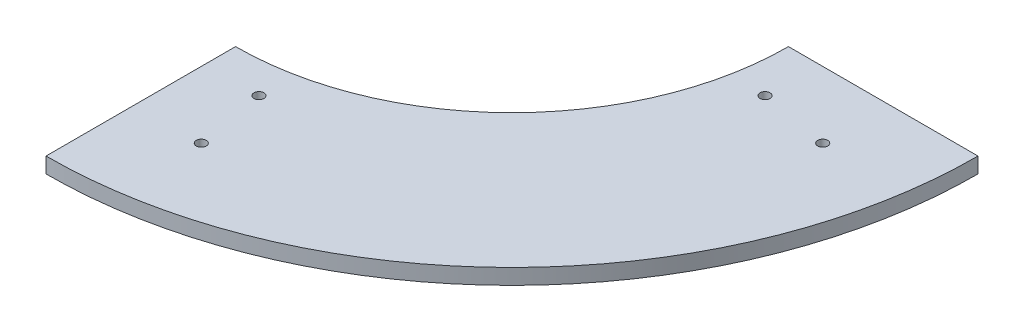
from build123d import *

# Parameters (mm, degrees)
BOSS_EXTRUDE1_DEPTH = 6.25
SKETCH2_R           = 2
CUT_EXTRUDE1_DEPTH  = 6.35


with BuildPart() as part:
    # Sketch1 → Boss-Extrude1 (new body)
    with BuildSketch(Plane(origin=(0, 0, 0), x_dir=(1, 0, 0), z_dir=(0, 1, 0))):
        with BuildLine():
            Line((111.125, 0), (187.325, 0))
            ThreePointArc((187.325, 0), (132.458777786, -132.458777786), (0, -187.325))
            Line((0, -187.325), (0, -111.125))
            ThreePointArc((0, -111.125), (78.577241059, -78.577241059), (111.125, 0))
        make_face()
    extrude(amount=BOSS_EXTRUDE1_DEPTH)

    # Sketch2 → Cut-Extrude1 (cut)
    with BuildSketch(Plane(origin=(0, 6.25, 0), x_dir=(1, 0, 0), z_dir=(0, 1, 0))):
        with Locations(Location((21.777652082, -123.507202325, 0), (0, 0, 270))):
            Circle(SKETCH2_R)
        with Locations(Location((123.507202325, -21.777652082, 0), (0, 0, 270))):
            Circle(SKETCH2_R)
        with Locations(Location((26.739648758, -151.648083867, 0), (0, 0, 270))):
            Circle(SKETCH2_R)
        with Locations(Location((151.648083867, -26.739648758, 0), (0, 0, 270))):
            Circle(SKETCH2_R)
    extrude(amount=-CUT_EXTRUDE1_DEPTH, mode=Mode.SUBTRACT)


solid = part.part
